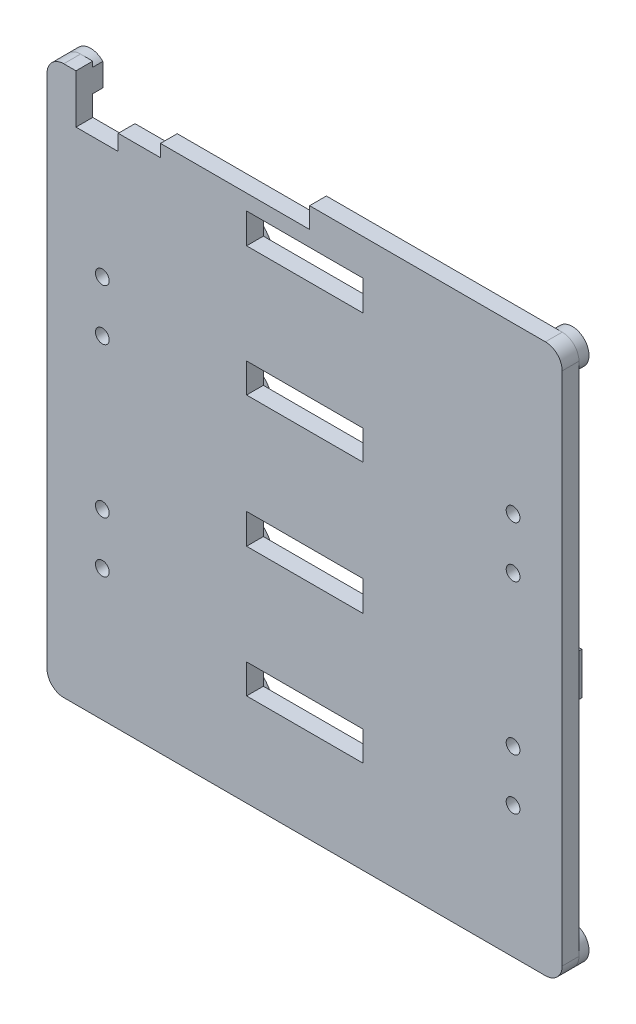
from build123d import *

# Parameters (mm, degrees)
EXTRUDE_1_DEPTH     = 5
SKETCH_3_R          = 5
SKETCH_3_R_2        = 2
SKETCH_3_R_3        = 9.625
SKETCH_3_W          = 10.613932385
SKETCH_3_H          = 24.88577967
SKETCH_3_W_2        = 38.95820767
SKETCH_3_H_2        = 12.594251912
SKETCH_3_W_3        = 13.578804677
SKETCH_3_H_3        = 34.152759808
SKETCH_3_W_4        = 12.099448383
SKETCH_3_H_4        = 23.089785548
SKETCH_3_W_5        = 7.606441364
SKETCH_3_H_5        = 22.816285271
SKETCH_3_W_6        = 11.173343953
SKETCH_3_H_6        = 22.816295648
EXTRUDE_2_DEPTH     = 3.000010807
SKETCH_4_W          = 34.770202637
SKETCH_4_H          = 8.999999561
SKETCH_4_H_2        = 8.7999989
SKETCH_4_H_3        = 8.999999684
SKETCH_4_H_4        = 8.799999888
CUT_EXTRUDE_1_DEPTH = 162.310734534
SKETCH_5_R          = 2.05
CUT_EXTRUDE_2_DEPTH = 5


with BuildPart() as part:
    # 草图1 → 凸台-拉伸1 (new body)
    with BuildSketch(Plane(origin=(-1.862e-06, -3.723e-06, -42.591431388), x_dir=(-0.999999999999999, 3.821371455846319e-15, 4.3711395709347256e-08), z_dir=(-4.371139570934742e-08, -8.742277371457049e-08, -0.9999999999999953))):
        with BuildLine():
            Line((41.409226449, 120.237361108), (-102.238542261, 120.237348614))
            ThreePointArc((-102.238542261, 120.237348614), (-105.774157813, 118.772848341), (-107.238657471, 115.237232534))
            Line((-107.238657471, 115.237232534), (-107.238644101, -38.484242555))
            ThreePointArc((-107.238644101, -38.484242555), (-105.774643614, -42.018651515), (-102.2402344, -43.482651386))
            Line((-102.2402344, -43.482651386), (41.410947067, -43.482638892))
            ThreePointArc((41.410947067, -43.482638892), (44.945356028, -42.018638406), (46.409355899, -38.484229191))
            Line((46.409355899, -38.484229191), (46.409342529, 115.237245898))
            ThreePointArc((46.409342529, 115.237245898), (44.944842256, 118.77286145), (41.409226449, 120.237361108))
        make_face()
    extrude(amount=EXTRUDE_1_DEPTH)

    # 草图3 → 凸台-拉伸2 (add)
    # profile 1 of 18: a face of its own
    with BuildSketch(Plane(origin=(-2.08e-06, -4.161e-06, -47.591431388), x_dir=(-0.999999999999999, 3.82137145584633e-15, 4.371139570934726e-08), z_dir=(-4.371139570934743e-08, -8.742277371457055e-08, -0.9999999999999953))):
        with Locations(Location((41.410536808, 115.237015701, 0), (0, 0, 358.747688186))):
            Circle(SKETCH_3_R)
        with Locations(Location((41.410536808, 115.237015701, 0), (0, 0, 90))):
            Circle(SKETCH_3_R_2, mode=Mode.SUBTRACT)
    # profile 2 of 18: a face of its own
    with BuildSketch(Plane(origin=(-2.08e-06, -4.161e-06, -47.591431388), x_dir=(-0.999999999999999, 3.82137145584633e-15, 4.371139570934726e-08), z_dir=(-4.371139570934743e-08, -8.742277371457055e-08, -0.9999999999999953))):
        with Locations(Location((-102.237463192, 115.237005324, 0), (0, 0, 90))):
            Circle(SKETCH_3_R)
        with Locations(Location((-102.237463192, 115.237005324, 0), (0, 0, 90))):
            Circle(SKETCH_3_R_2, mode=Mode.SUBTRACT)
    # profile 3 of 18: a face of its own
    with BuildSketch(Plane(origin=(-2.08e-06, -4.161e-06, -47.591431388), x_dir=(-0.999999999999999, 3.82137145584633e-15, 4.371139570934726e-08), z_dir=(-4.371139570934743e-08, -8.742277371457055e-08, -0.9999999999999953))):
        with Locations(Location((-102.237452088, -38.482994676, 0), (0, 0, 270.671411315))):
            Circle(SKETCH_3_R)
        with Locations(Location((-102.237452088, -38.482994676, 0), (0, 0, 90))):
            Circle(SKETCH_3_R_2, mode=Mode.SUBTRACT)
    # profile 4 of 18: a face of its own
    with BuildSketch(Plane(origin=(-2.08e-06, -4.161e-06, -47.591431388), x_dir=(-0.999999999999999, 3.82137145584633e-15, 4.371139570934726e-08), z_dir=(-4.371139570934743e-08, -8.742277371457055e-08, -0.9999999999999953))):
        with Locations(Location((41.410547912, -38.482984299, 0), (0, 0, 269.326531026))):
            Circle(SKETCH_3_R)
        with Locations(Location((41.410547912, -38.482984299, 0), (0, 0, 90))):
            Circle(SKETCH_3_R_2, mode=Mode.SUBTRACT)
    # profile 5 of 18: a face of its own
    with BuildSketch(Plane(origin=(-2.08e-06, -4.161e-06, -47.591431388), x_dir=(-0.999999999999999, 3.82137145584633e-15, 4.371139570934726e-08), z_dir=(-4.371139570934743e-08, -8.742277371457055e-08, -0.9999999999999953))):
        with Locations(Location((-3.596630433, 93.011893388, 0), (0, 0, 90))):
            Circle(SKETCH_3_R_3)
    # profile 6 of 18: a face of its own
    with BuildSketch(Plane(origin=(-2.08e-06, -4.161e-06, -47.591431388), x_dir=(-0.999999999999999, 3.82137145584633e-15, 4.371139570934726e-08), z_dir=(-4.371139570934743e-08, -8.742277371457055e-08, -0.9999999999999953))):
        with Locations(Location((-3.581016316, 54.203604591, 0), (0, 0, 90))):
            Circle(SKETCH_3_R_3)
    # profile 7 of 18: a face of its own
    with BuildSketch(Plane(origin=(-2.08e-06, -4.161e-06, -47.591431388), x_dir=(-0.999999999999999, 3.82137145584633e-15, 4.371139570934726e-08), z_dir=(-4.371139570934743e-08, -8.742277371457055e-08, -0.9999999999999953))):
        with Locations(Location((-59.085827047, 90.041837762, 0), (0, 0, 90))):
            Circle(SKETCH_3_R_3)
    # profile 8 of 18: a face of its own
    with BuildSketch(Plane(origin=(-2.08e-06, -4.161e-06, -47.591431388), x_dir=(-0.999999999999999, 3.82137145584633e-15, 4.371139570934726e-08), z_dir=(-4.371139570934743e-08, -8.742277371457055e-08, -0.9999999999999953))):
        with Locations(Location((-59.07021293, 51.233548965, 0), (0, 0, 90))):
            Circle(SKETCH_3_R_3)
    # profile 9 of 18: a face of its own
    with BuildSketch(Plane(origin=(-2.08e-06, -4.161e-06, -47.591431388), x_dir=(-0.999999999999999, 3.82137145584633e-15, 4.371139570934726e-08), z_dir=(-4.371139570934743e-08, -8.742277371457055e-08, -0.9999999999999953))):
        with Locations(Location((-59.038984696, -26.38302863, 0), (0, 0, 90))):
            Circle(SKETCH_3_R_3)
    # profile 10 of 18: a face of its own
    with BuildSketch(Plane(origin=(-2.08e-06, -4.161e-06, -47.591431388), x_dir=(-0.999999999999999, 3.82137145584633e-15, 4.371139570934726e-08), z_dir=(-4.371139570934743e-08, -8.742277371457055e-08, -0.9999999999999953))):
        with Locations(Location((-59.054598813, 12.425260168, 0), (0, 0, 90))):
            Circle(SKETCH_3_R_3)
    # profile 11 of 18: a face of its own
    with BuildSketch(Plane(origin=(-2.08e-06, -4.161e-06, -47.591431388), x_dir=(-0.999999999999999, 3.82137145584633e-15, 4.371139570934726e-08), z_dir=(-4.371139570934743e-08, -8.742277371457055e-08, -0.9999999999999953))):
        with Locations(Location((-3.565402199, 15.395315794, 0), (0, 0, 90))):
            Circle(SKETCH_3_R_3)
    # profile 12 of 18: a face of its own
    with BuildSketch(Plane(origin=(-2.08e-06, -4.161e-06, -47.591431388), x_dir=(-0.999999999999999, 3.82137145584633e-15, 4.371139570934726e-08), z_dir=(-4.371139570934743e-08, -8.742277371457055e-08, -0.9999999999999953))):
        with Locations(Location((-3.549788083, -23.412973003, 0), (0, 0, 90))):
            Circle(SKETCH_3_R_3)
    # profile 13 of 18: a face of its own
    with BuildSketch(Plane(origin=(-2.08e-06, -4.161e-06, -47.591431388), x_dir=(-0.999999999999999, 3.82137145584633e-15, 4.371139570934726e-08), z_dir=(-4.371139570934743e-08, -8.742277371457055e-08, -0.9999999999999953))):
        with Locations((16.725357866, 32.884779703)):
            Rectangle(SKETCH_3_W, SKETCH_3_H)
    # profile 14 of 18: a face of its own
    with BuildSketch(Plane(origin=(-2.08e-06, -4.161e-06, -47.591431388), x_dir=(-0.999999999999999, 3.82137145584633e-15, 4.371139570934726e-08), z_dir=(-4.371139570934743e-08, -8.742277371457055e-08, -0.9999999999999953))):
        with Locations((-85.599555359, 31.977193272)):
            Rectangle(SKETCH_3_W_2, SKETCH_3_H_2)
    # profile 15 of 18: a face of its own
    with BuildSketch(Plane(origin=(-2.08e-06, -4.161e-06, -47.591431388), x_dir=(-0.999999999999999, 3.82137145584633e-15, 4.371139570934726e-08), z_dir=(-4.371139570934743e-08, -8.742277371457055e-08, -0.9999999999999953))):
        with Locations((-83.029780824, 99.475208401)):
            Rectangle(SKETCH_3_W_3, SKETCH_3_H_3)
    # profile 16 of 18: a face of its own
    with BuildSketch(Plane(origin=(-2.08e-06, -4.161e-06, -47.591431388), x_dir=(-0.999999999999999, 3.82137145584633e-15, 4.371139570934726e-08), z_dir=(-4.371139570934743e-08, -8.742277371457055e-08, -0.9999999999999953))):
        with Locations((20.52598148, 91.111293657)):
            Rectangle(SKETCH_3_W_4, SKETCH_3_H_4)
    # profile 17 of 18: a face of its own
    with BuildSketch(Plane(origin=(-2.08e-06, -4.161e-06, -47.591431388), x_dir=(-0.999999999999999, 3.82137145584633e-15, 4.371139570934726e-08), z_dir=(-4.371139570934743e-08, -8.742277371457055e-08, -0.9999999999999953))):
        with Locations((20.528578547, -27.074841664)):
            Rectangle(SKETCH_3_W_5, SKETCH_3_H_5)
    # profile 18 of 18: a face of its own
    with BuildSketch(Plane(origin=(-2.08e-06, -4.161e-06, -47.591431388), x_dir=(-0.999999999999999, 3.82137145584633e-15, 4.371139570934726e-08), z_dir=(-4.371139570934743e-08, -8.742277371457055e-08, -0.9999999999999953))):
        with Locations((-81.827050462, -27.074846852)):
            Rectangle(SKETCH_3_W_6, SKETCH_3_H_6)
    extrude(amount=EXTRUDE_2_DEPTH)

    # 草图4 → 切除-拉伸1 (cut, through all)
    with BuildSketch(Plane(origin=(-1.862e-06, -3.723e-06, -42.591431388), x_dir=(0.999999999999999, -3.82137145584633e-15, -4.371139570934726e-08), z_dir=(4.371139570934743e-08, 8.742277371457055e-08, 0.9999999999999953))):
        Polygon((-37.763537221, 120.820237071), (-37.763537221, 105.691011748), (-25.163537193, 105.691011748), (-25.163537193, 110.396009133), (-12.571548802, 110.396009133), (-12.571548802, 114.090654782), (31.907466714, 114.090654782), (31.907466714, 120.820232038), align=None)
        with Locations((30.500346202, 104.974023786)):
            Rectangle(SKETCH_4_W, SKETCH_4_H)
        with Locations((30.500346202, 66.339022733)):
            Rectangle(SKETCH_4_W, SKETCH_4_H_2)
        with Locations((30.500346202, 27.377023796)):
            Rectangle(SKETCH_4_W, SKETCH_4_H_3)
        with Locations((30.500346202, -11.384979611)):
            Rectangle(SKETCH_4_W, SKETCH_4_H_4)
    extrude(amount=-CUT_EXTRUDE_1_DEPTH, mode=Mode.SUBTRACT)

    # 草图5 → 切除-拉伸2 (cut)
    with BuildSketch(Plane(origin=(-1.862e-06, -3.723e-06, -42.591431388), x_dir=(0.999999999999999, -3.82137145584633e-15, -4.371139570934726e-08), z_dir=(4.371139570934742e-08, 8.742277371457052e-08, 0.9999999999999952))):
        with Locations(Location((-29.909346382, 70.939437705, 0), (0, 0, 270))):
            Circle(SKETCH_5_R)
        with Locations(Location((-29.909347708, 55.689437705, 0), (0, 0, 270))):
            Circle(SKETCH_5_R)
        with Locations(Location((-29.9093516, 10.939437705, 0), (0, 0, 270))):
            Circle(SKETCH_5_R)
        with Locations(Location((-29.909352927, -4.310562295, 0), (0, 0, 270))):
            Circle(SKETCH_5_R)
        with Locations(Location((92.590647073, -4.31057295, 0), (0, 0, 270))):
            Circle(SKETCH_5_R)
        with Locations(Location((92.5906484, 10.93942705, 0), (0, 0, 270))):
            Circle(SKETCH_5_R)
        with Locations(Location((92.590652292, 55.68942705, 0), (0, 0, 270))):
            Circle(SKETCH_5_R)
        with Locations(Location((92.590653618, 70.93942705, 0), (0, 0, 270))):
            Circle(SKETCH_5_R)
    extrude(amount=-CUT_EXTRUDE_2_DEPTH, mode=Mode.SUBTRACT)


solid = part.part
